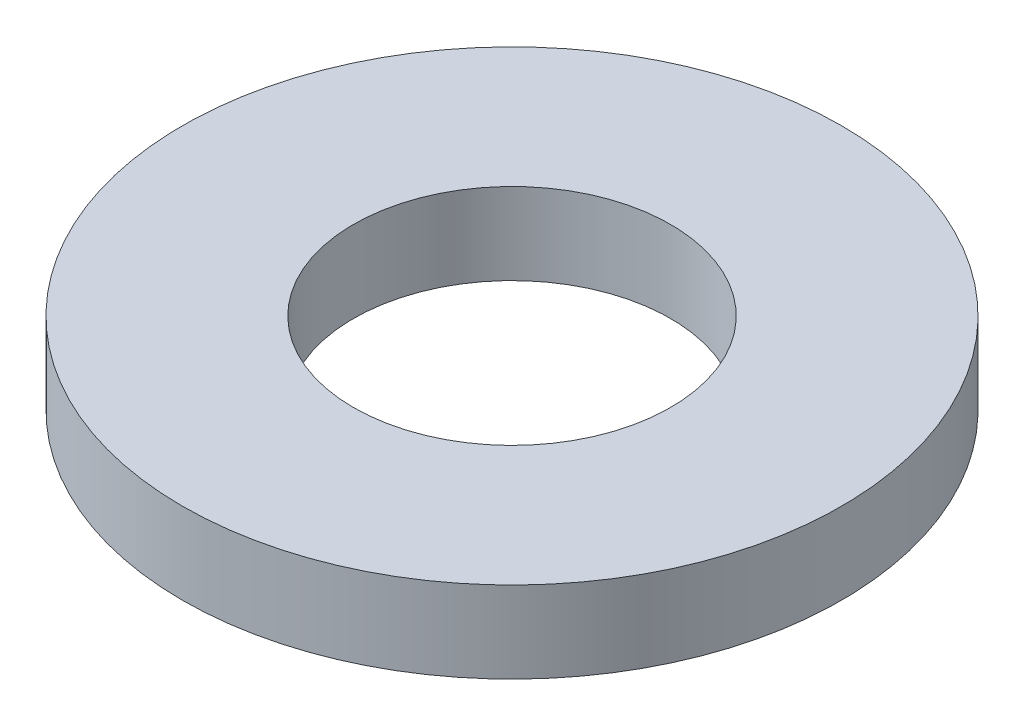
from build123d import *

# Parameters (mm, degrees)
SKETCH1_R           = 93
SKETCH1_R_2         = 44.75
BOSS_EXTRUDE1_DEPTH = 23


with BuildPart() as part:
    # Sketch1 → Boss-Extrude1 (new body)
    with BuildSketch(Plane(origin=(0, 0, 0), x_dir=(1, 0, 0), z_dir=(0, 1, 0))):
        with Locations(Location((0, 0, 0), (0, 0, 270))):
            Circle(SKETCH1_R)
        with Locations(Location((0, 0, 0), (0, 0, 270))):
            Circle(SKETCH1_R_2, mode=Mode.SUBTRACT)
    extrude(amount=BOSS_EXTRUDE1_DEPTH)


solid = part.part
